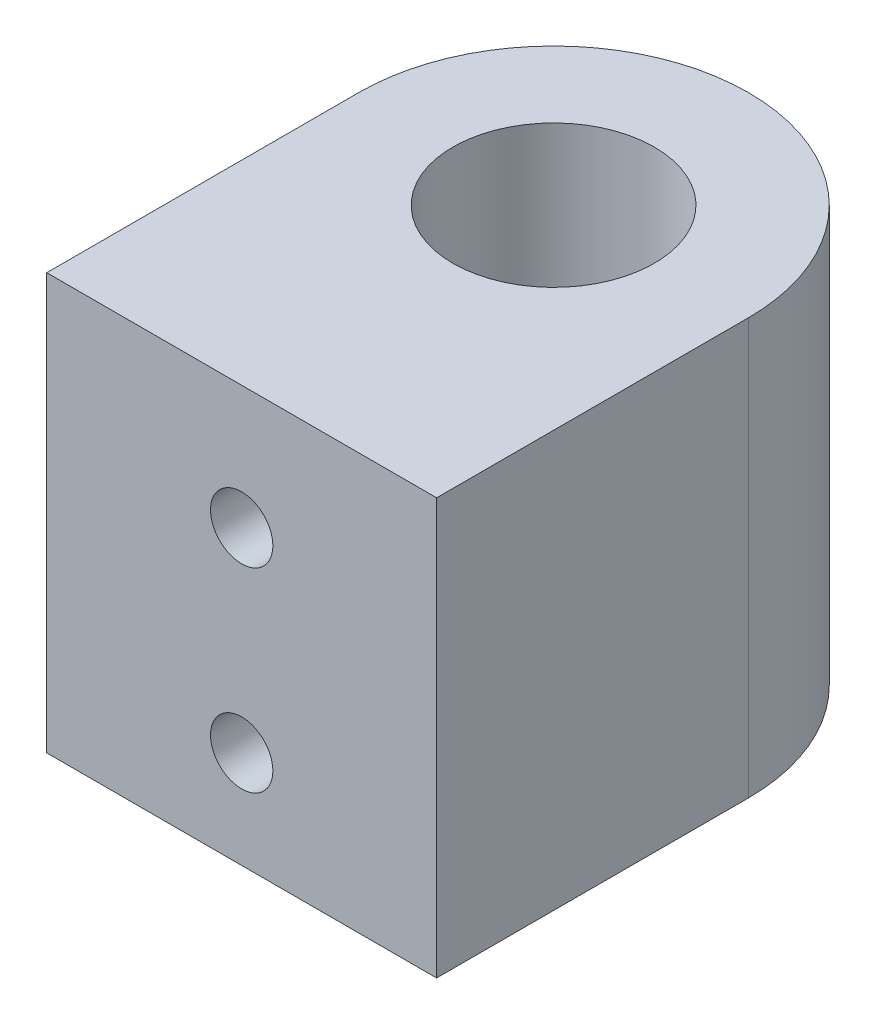
from build123d import *

# Parameters (mm, degrees)
SKETCH1_R           = 7.75
BOSS_EXTRUDE1_DEPTH = 30
SKETCH2_R           = 7.75
SKETCH2_R_2         = 5
BOSS_EXTRUDE2_DEPTH = 7
SKETCH3_R           = 2.4
CUT_EXTRUDE1_DEPTH  = 27
SKETCH4_R           = 7.75
BOSS_EXTRUDE3_DEPTH = 2


with BuildPart() as part:
    # Sketch1 → Boss-Extrude1 (new body)
    with BuildSketch(Plane(origin=(0, 0, 0), x_dir=(1, 0, 0), z_dir=(0, 1, 0))):
        with BuildLine():
            Line((-15, 0), (-15, -24))
            Line((-15, -24), (15, -24))
            Line((15, -24), (15, 0))
            ThreePointArc((15, 0), (0, 15), (-15, 0))
        make_face()
        with Locations(Location((0, 0, 0), (0, 0, 270))):
            Circle(SKETCH1_R, mode=Mode.SUBTRACT)
    extrude(amount=BOSS_EXTRUDE1_DEPTH)

    # Sketch2 → Boss-Extrude2 (add)
    with BuildSketch(Plane.XZ):
        with Locations(Location((0, 0, 0), (0, 0, 270))):
            Circle(SKETCH2_R)
        with Locations(Location((0, 0, 0), (0, 0, 270))):
            Circle(SKETCH2_R_2, mode=Mode.SUBTRACT)
    extrude(amount=-BOSS_EXTRUDE2_DEPTH)

    # Sketch3 → Cut-Extrude1 (cut)
    with BuildSketch(Plane.XY.offset(24)):
        with Locations((0, 22.5)):
            Circle(SKETCH3_R)
        with Locations((0, 7.5)):
            Circle(SKETCH3_R)
    extrude(amount=-CUT_EXTRUDE1_DEPTH, mode=Mode.SUBTRACT)

    # Sketch4 → Boss-Extrude3 (add)
    with BuildSketch(Plane(origin=(0, 30, 0), x_dir=(1, 0, 0), z_dir=(0, 1, 0))):
        with BuildLine():
            Line((-15, 0), (-15, -24))
            Line((-15, -24), (15, -24))
            Line((15, -24), (15, 0))
            ThreePointArc((15, 0), (0, 15), (-15, 0))
        make_face()
        with Locations(Location((0, 0, 0), (0, 0, 252.369188241))):
            Circle(SKETCH4_R, mode=Mode.SUBTRACT)
    extrude(amount=BOSS_EXTRUDE3_DEPTH)


solid = part.part
